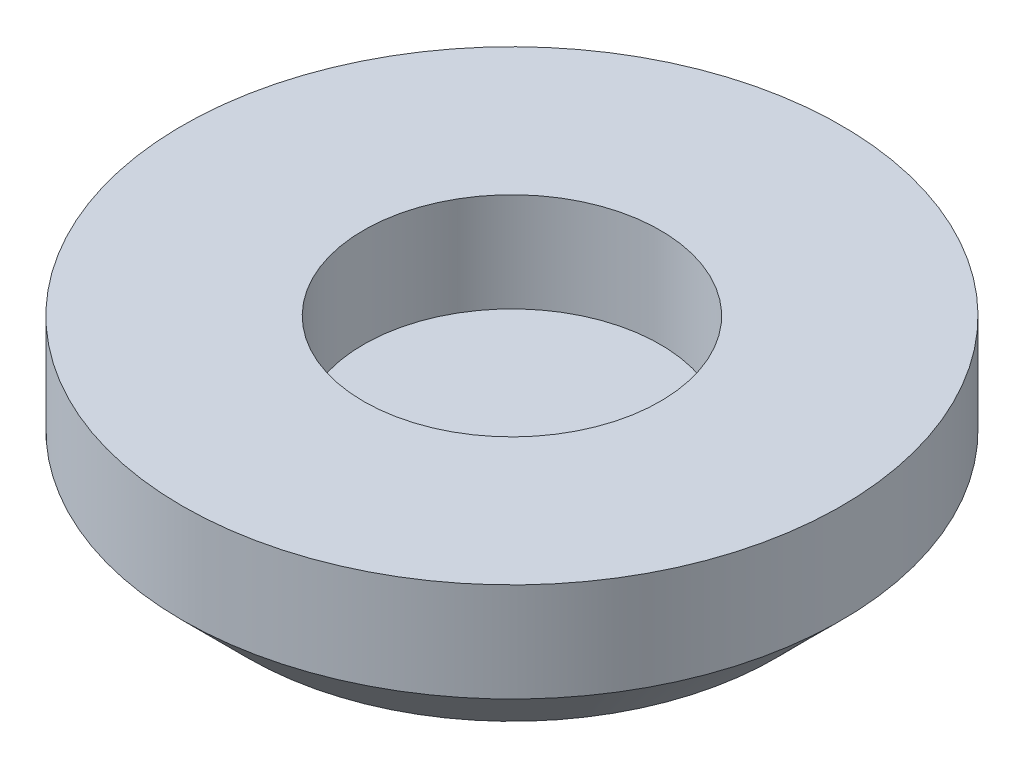
from build123d import *

# Parameters (mm, degrees)
SKETCH_1_R          = 10
EXTRUDE_1_DEPTH     = 5
SKETCH_2_R          = 4.5
CUT_EXTRUDE_1_DEPTH = 3
CHAMFER_1_SIZE      = 2


with BuildPart() as part:
    # 草圖1 → 填料-伸長1 (new body)
    with BuildSketch(Plane(origin=(0, 0, 0), x_dir=(1, 0, 0), z_dir=(0, 1, 0))):
        with Locations(Location((0, 0, 0), (0, 0, 270))):
            Circle(SKETCH_1_R)
    extrude(amount=EXTRUDE_1_DEPTH)

    # 草圖2 → 除料-伸長1 (cut)
    with BuildSketch(Plane(origin=(0, 5, 0), x_dir=(1, 0, 0), z_dir=(0, 1, 0))):
        with Locations(Location((0, 0, 0), (0, 0, 270))):
            Circle(SKETCH_2_R)
    extrude(amount=-CUT_EXTRUDE_1_DEPTH, mode=Mode.SUBTRACT)

    # 導角1
    chamfer_1_edges = [part.edges().sort_by_distance(p)[0] for p in [
        (0, 0, -10),
    ]]
    chamfer(chamfer_1_edges, length=CHAMFER_1_SIZE)


solid = part.part
